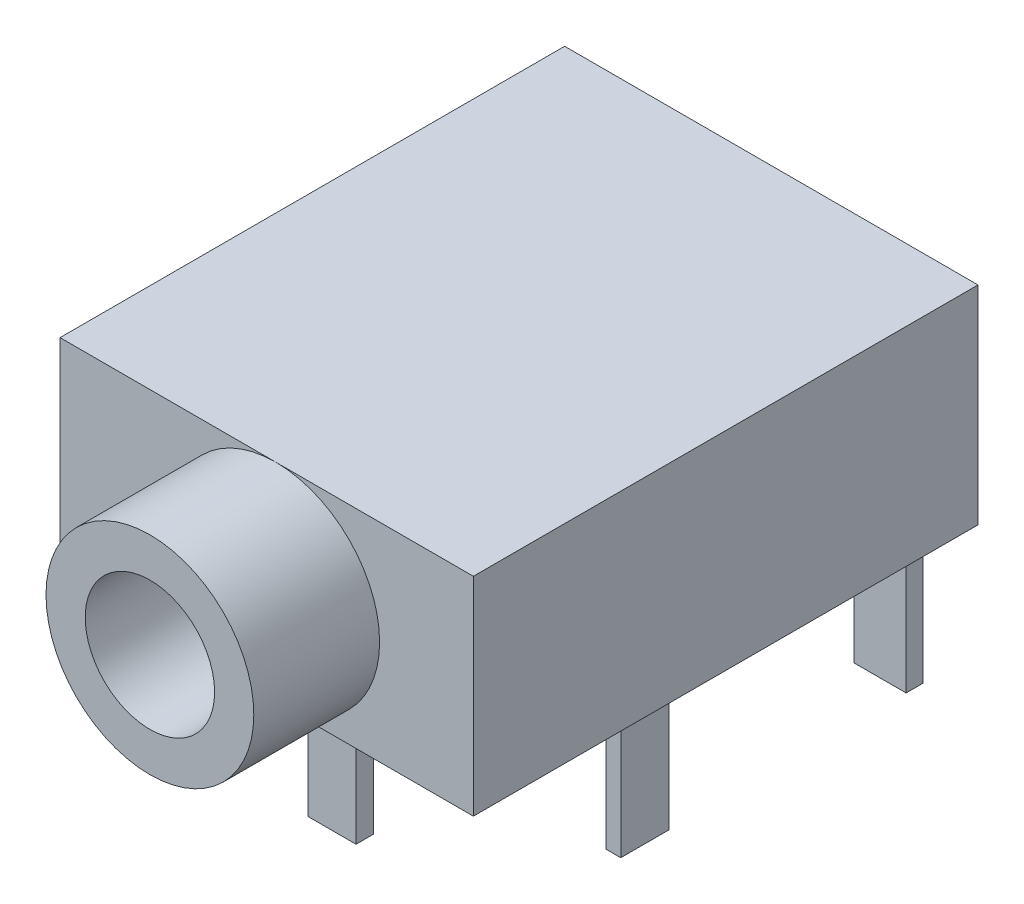
from build123d import *

# Parameters (mm, degrees)
SKETCH_1_W      = 14.039038814
SKETCH_1_H      = 5.781099621
EXTRUDE_1_DEPTH = 5.75
SKETCH_2_R      = 2.89054981
SKETCH_2_R_2    = 1.8
EXTRUDE_2_DEPTH = 3.5
SKETCH_3_W      = 1.445545422
SKETCH_3_H      = 0.46914779
SKETCH_3_W_2    = 0.440036949
SKETCH_3_H_2    = 1.412750204
SKETCH_3_W_3    = 0.463196789
SKETCH_3_H_3    = 1.435910044
SKETCH_3_W_4    = 0.41687711
SKETCH_3_H_4    = 1.343270685
SKETCH_3_W_5    = 1.343270686
SKETCH_3_H_5    = 0.486356628
EXTRUDE_3_DEPTH = 4


with BuildPart() as part:
    # Эскиз1 → Бобышка-Вытянуть1 (new, symmetric)
    with BuildSketch(Plane(origin=(0, 0, 0), x_dir=(0, 0, -1), z_dir=(1, 0, 0))):
        with Locations((7.031108734, 2.884562427)):
            Rectangle(SKETCH_1_W, SKETCH_1_H)
    extrude(amount=EXTRUDE_1_DEPTH, both=True)

    # Эскиз2 → Бобышка-Вытянуть2 (add)
    with BuildSketch(Plane.XY.offset(-0.011589327)):
        with Locations(Location((0.25, 2.884562426, 0), (0, 0, 270))):
            Circle(SKETCH_2_R)
        with Locations((0.25, 2.884562426)):
            Circle(SKETCH_2_R_2, mode=Mode.SUBTRACT)
    extrude(amount=EXTRUDE_2_DEPTH)

    # Эскиз3 → Бобышка-Вытянуть3 (add)
    with BuildSketch(Plane.XZ.offset(0.005987384)):
        with Locations((4.077721902, -13.234721413)):
            Rectangle(SKETCH_3_W, SKETCH_3_H)
        with Locations((-4.845578503, -10.005870434)):
            Rectangle(SKETCH_3_W_2, SKETCH_3_H_2)
        with Locations((-2.402215445, -8.743659186)):
            Rectangle(SKETCH_3_W_3, SKETCH_3_H_3)
        with Locations((4.592056058, -5.732880063)):
            Rectangle(SKETCH_3_W_4, SKETCH_3_H_4)
        with Locations((0.122207051, -1.946246319)):
            Rectangle(SKETCH_3_W_5, SKETCH_3_H_5)
    extrude(amount=EXTRUDE_3_DEPTH)


solid = part.part
